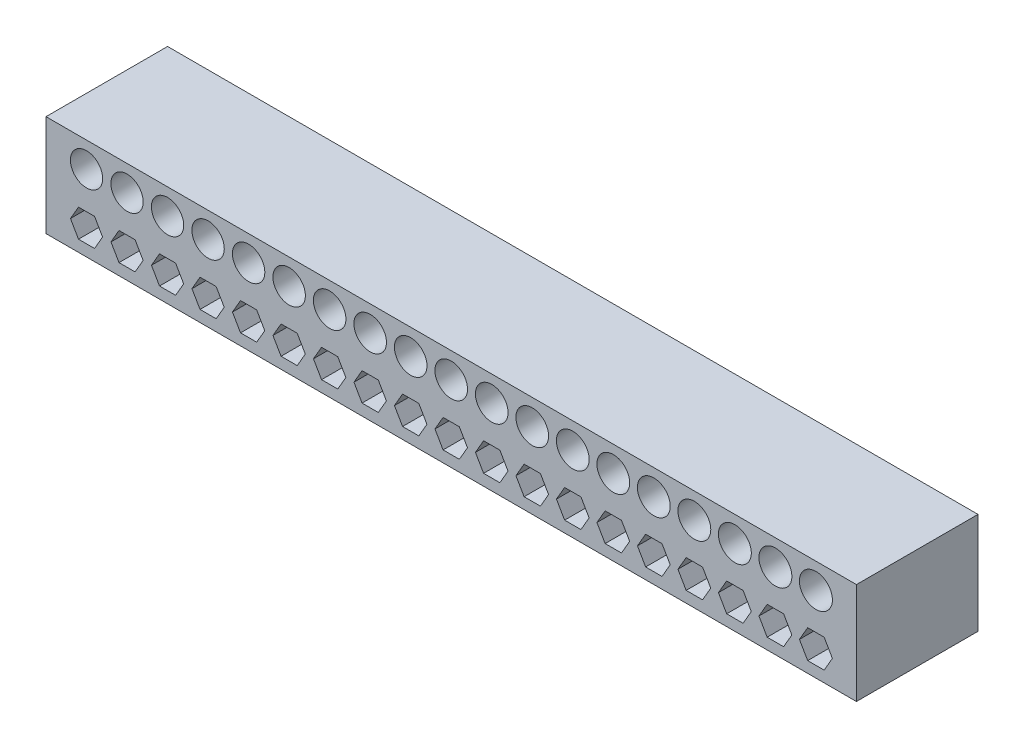
from build123d import *

# Parameters (mm, degrees)
SKETCH1_W           = 200
SKETCH1_H           = 25
SKETCH1_R           = 3.98
SKETCH1_R_2         = 3.985
SKETCH1_R_3         = 3.99
SKETCH1_R_4         = 3.995
SKETCH1_R_5         = 4
SKETCH1_R_6         = 4.005
SKETCH1_R_7         = 4.01
SKETCH1_R_8         = 4.015
SKETCH1_R_9         = 4.02
SKETCH1_R_10        = 4.025
SKETCH1_R_11        = 4.03
SKETCH1_R_12        = 4.035
SKETCH1_R_13        = 4.04
SKETCH1_R_14        = 4.045
SKETCH1_R_15        = 4.05
SKETCH1_R_16        = 4.055
SKETCH1_R_17        = 4.06
SKETCH1_R_18        = 4.065
SKETCH1_R_19        = 4.07
BOSS_EXTRUDE1_DEPTH = 30


with BuildPart() as part:
    # Sketch1 → Boss-Extrude1 (new body)
    with BuildSketch(Plane.XY):
        Rectangle(SKETCH1_W, SKETCH1_H)
        with Locations((-90, 6.25)):
            Circle(SKETCH1_R, mode=Mode.SUBTRACT)
        with Locations((-80, 6.25)):
            Circle(SKETCH1_R_2, mode=Mode.SUBTRACT)
        with Locations((-70, 6.25)):
            Circle(SKETCH1_R_3, mode=Mode.SUBTRACT)
        with Locations((-60, 6.25)):
            Circle(SKETCH1_R_4, mode=Mode.SUBTRACT)
        with Locations((-50, 6.25)):
            Circle(SKETCH1_R_5, mode=Mode.SUBTRACT)
        with Locations((-40, 6.25)):
            Circle(SKETCH1_R_6, mode=Mode.SUBTRACT)
        with Locations((-30, 6.25)):
            Circle(SKETCH1_R_7, mode=Mode.SUBTRACT)
        with Locations((-20, 6.25)):
            Circle(SKETCH1_R_8, mode=Mode.SUBTRACT)
        with Locations((-10, 6.25)):
            Circle(SKETCH1_R_9, mode=Mode.SUBTRACT)
        with Locations((0, 6.25)):
            Circle(SKETCH1_R_10, mode=Mode.SUBTRACT)
        with Locations((10, 6.25)):
            Circle(SKETCH1_R_11, mode=Mode.SUBTRACT)
        with Locations((20, 6.25)):
            Circle(SKETCH1_R_12, mode=Mode.SUBTRACT)
        with Locations((30, 6.25)):
            Circle(SKETCH1_R_13, mode=Mode.SUBTRACT)
        with Locations((40, 6.25)):
            Circle(SKETCH1_R_14, mode=Mode.SUBTRACT)
        with Locations((50, 6.25)):
            Circle(SKETCH1_R_15, mode=Mode.SUBTRACT)
        with Locations((60, 6.25)):
            Circle(SKETCH1_R_16, mode=Mode.SUBTRACT)
        with Locations((70, 6.25)):
            Circle(SKETCH1_R_17, mode=Mode.SUBTRACT)
        with Locations((80, 6.25)):
            Circle(SKETCH1_R_18, mode=Mode.SUBTRACT)
        with Locations((90, 6.25)):
            Circle(SKETCH1_R_19, mode=Mode.SUBTRACT)
        Polygon((-91.981236116, -2.818398385), (-88.018763884, -2.818398385), (-86.037527767, -6.25), (-88.018763884, -9.681601615), (-91.981236116, -9.681601615), (-93.962472233, -6.25), align=None, mode=Mode.SUBTRACT)
        Polygon((-81.984122868, -2.813398385), (-78.015877132, -2.813398385), (-76.031754265, -6.25), (-78.015877132, -9.686601615), (-81.984122868, -9.686601615), (-83.968245735, -6.25), align=None, mode=Mode.SUBTRACT)
        Polygon((-71.987009619, -2.808398385), (-68.012990381, -2.808398385), (-66.025980762, -6.25), (-68.012990381, -9.691601615), (-71.987009619, -9.691601615), (-73.974019238, -6.25), align=None, mode=Mode.SUBTRACT)
        Polygon((-61.98989637, -2.803398385), (-58.01010363, -2.803398385), (-56.020207259, -6.25), (-58.01010363, -9.696601615), (-61.98989637, -9.696601615), (-63.979792741, -6.25), align=None, mode=Mode.SUBTRACT)
        Polygon((-51.992783122, -2.798398385), (-48.007216878, -2.798398385), (-46.014433757, -6.25), (-48.007216878, -9.701601615), (-51.992783122, -9.701601615), (-53.985566243, -6.25), align=None, mode=Mode.SUBTRACT)
        Polygon((-41.995669873, -2.793398385), (-38.004330127, -2.793398385), (-36.008660254, -6.25), (-38.004330127, -9.706601615), (-41.995669873, -9.706601615), (-43.991339746, -6.25), align=None, mode=Mode.SUBTRACT)
        Polygon((-31.998556624, -2.788398385), (-28.001443376, -2.788398385), (-26.002886751, -6.25), (-28.001443376, -9.711601615), (-31.998556624, -9.711601615), (-33.997113249, -6.25), align=None, mode=Mode.SUBTRACT)
        Polygon((-22.001443376, -2.783398385), (-17.998556624, -2.783398385), (-15.997113249, -6.25), (-17.998556624, -9.716601615), (-22.001443376, -9.716601615), (-24.002886751, -6.25), align=None, mode=Mode.SUBTRACT)
        Polygon((-12.004330127, -2.778398385), (-7.995669873, -2.778398385), (-5.991339746, -6.25), (-7.995669873, -9.721601615), (-12.004330127, -9.721601615), (-14.008660254, -6.25), align=None, mode=Mode.SUBTRACT)
        Polygon((-2.007216878, -2.773398385), (2.007216878, -2.773398385), (4.014433757, -6.25), (2.007216878, -9.726601615), (-2.007216878, -9.726601615), (-4.014433757, -6.25), align=None, mode=Mode.SUBTRACT)
        Polygon((7.98989637, -2.768398385), (12.01010363, -2.768398385), (14.020207259, -6.25), (12.01010363, -9.731601615), (7.98989637, -9.731601615), (5.979792741, -6.25), align=None, mode=Mode.SUBTRACT)
        Polygon((17.987009619, -2.763398385), (22.012990381, -2.763398385), (24.025980762, -6.25), (22.012990381, -9.736601615), (17.987009619, -9.736601615), (15.974019238, -6.25), align=None, mode=Mode.SUBTRACT)
        Polygon((27.984122868, -2.758398385), (32.015877132, -2.758398385), (34.031754265, -6.25), (32.015877132, -9.741601615), (27.984122868, -9.741601615), (25.968245735, -6.25), align=None, mode=Mode.SUBTRACT)
        Polygon((37.981236116, -2.753398385), (42.018763884, -2.753398385), (44.037527767, -6.25), (42.018763884, -9.746601615), (37.981236116, -9.746601615), (35.962472233, -6.25), align=None, mode=Mode.SUBTRACT)
        Polygon((47.978349365, -2.748398385), (52.021650635, -2.748398385), (54.04330127, -6.25), (52.021650635, -9.751601615), (47.978349365, -9.751601615), (45.95669873, -6.25), align=None, mode=Mode.SUBTRACT)
        Polygon((57.975462614, -2.743398385), (62.024537386, -2.743398385), (64.049074773, -6.25), (62.024537386, -9.756601615), (57.975462614, -9.756601615), (55.950925227, -6.25), align=None, mode=Mode.SUBTRACT)
        Polygon((67.972575862, -2.738398385), (72.027424138, -2.738398385), (74.054848276, -6.25), (72.027424138, -9.761601615), (67.972575862, -9.761601615), (65.945151724, -6.25), align=None, mode=Mode.SUBTRACT)
        Polygon((77.969689111, -2.733398385), (82.030310889, -2.733398385), (84.060621778, -6.25), (82.030310889, -9.766601615), (77.969689111, -9.766601615), (75.939378222, -6.25), align=None, mode=Mode.SUBTRACT)
        Polygon((87.96680236, -2.728398385), (92.03319764, -2.728398385), (94.066395281, -6.25), (92.03319764, -9.771601615), (87.96680236, -9.771601615), (85.933604719, -6.25), align=None, mode=Mode.SUBTRACT)
    extrude(amount=-BOSS_EXTRUDE1_DEPTH)


solid = part.part
